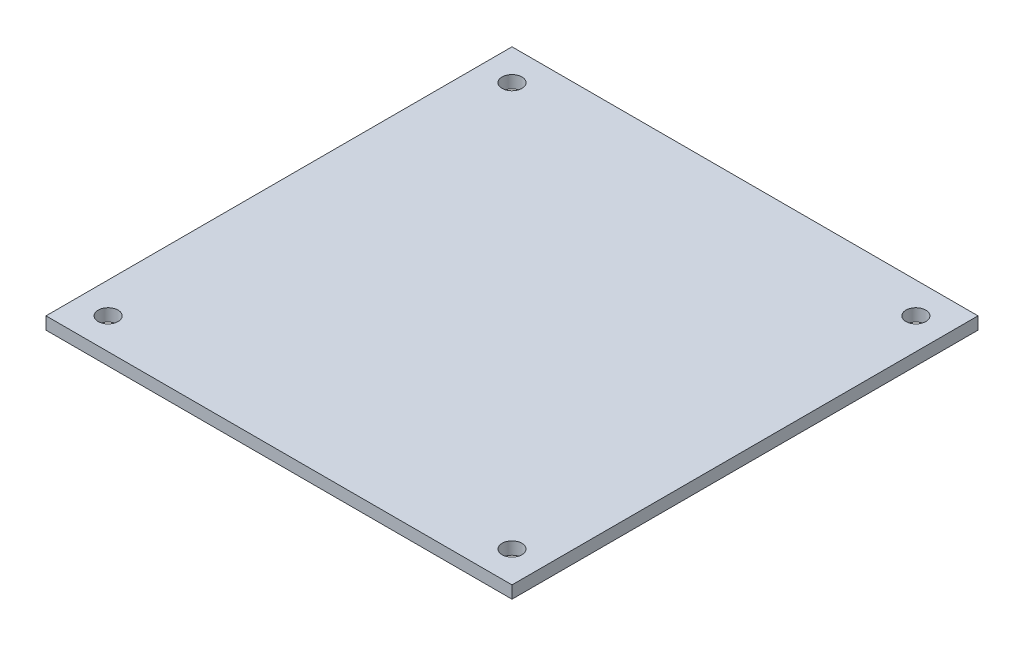
from build123d import *

# Parameters (mm, degrees)
SKETCH1_W           = 75
SKETCH1_H           = 75
SKETCH1_R           = 1.6
BOSS_EXTRUDE1_DEPTH = 2


with BuildPart() as part:
    # Sketch1 → Boss-Extrude1 (new body)
    with BuildSketch(Plane(origin=(0, 0, 0), x_dir=(1, 0, 0), z_dir=(0, 1, 0))):
        Rectangle(SKETCH1_W, SKETCH1_H)
        with Locations(Location((-32.5, 32.5, 0), (0, 0, 270))):
            Circle(SKETCH1_R, mode=Mode.SUBTRACT)
        with Locations(Location((-32.5, -32.5, 0), (0, 0, 270))):
            Circle(SKETCH1_R, mode=Mode.SUBTRACT)
        with Locations(Location((32.5, 32.5, 0), (0, 0, 270))):
            Circle(SKETCH1_R, mode=Mode.SUBTRACT)
        with Locations(Location((32.5, -32.5, 0), (0, 0, 270))):
            Circle(SKETCH1_R, mode=Mode.SUBTRACT)
    extrude(amount=BOSS_EXTRUDE1_DEPTH)


solid = part.part
